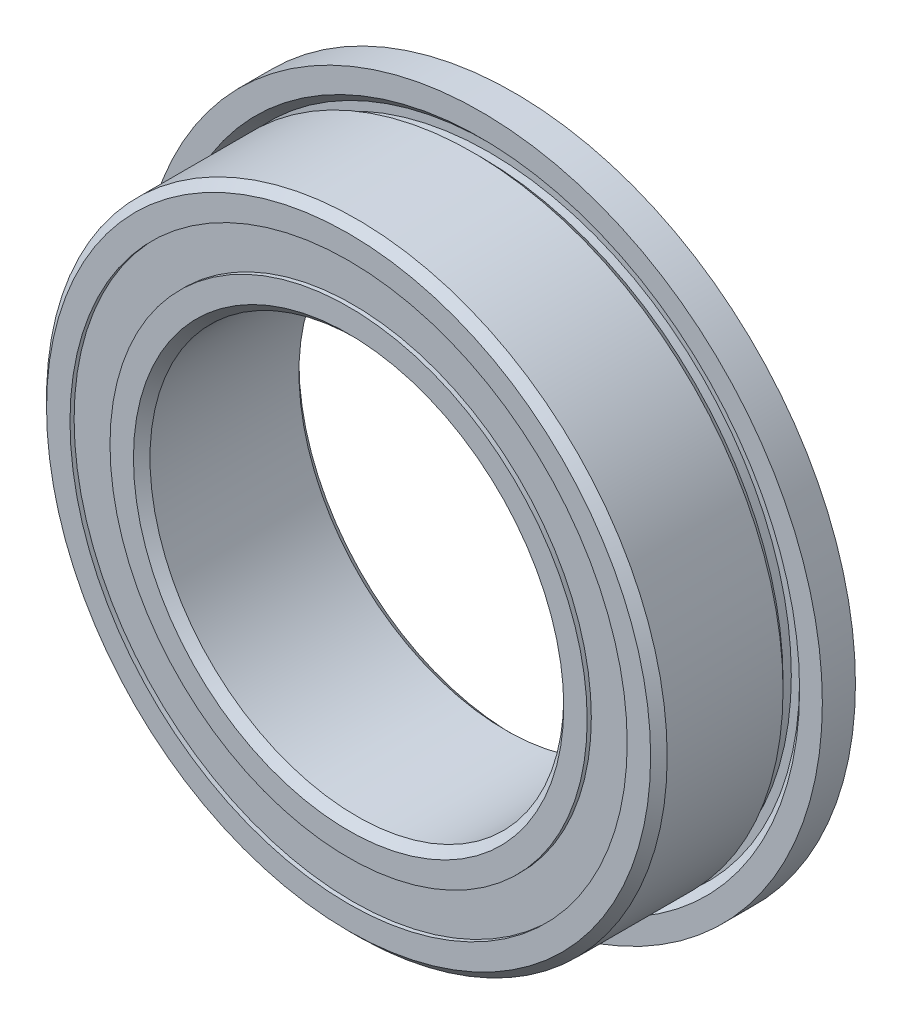
from build123d import *

# Parameters (mm, degrees)
SKETCH6_W         = 0.161172162
SKETCH6_H         = 0.483516484
CIRPATTERN1_COUNT = 11
SKETCH5_W         = 0.888114806
SKETCH5_H         = 0.967032968


with BuildPart() as part:
    # Sketch7 → Revolve7 (revolve)
    with BuildSketch(Plane(origin=(0, 0, 0), x_dir=(0, 0, -1), z_dir=(1, 0, 0)), mode=Mode.PRIVATE) as revolve7_sk:
        with BuildLine():
            Line((2, 8.25), (1.2, 8.25))
            Line((1.2, 8.25), (1.2, 7.7))
            Line((1.2, 7.7), (1.4, 7.5))
            Line((1.4, 7.5), (1.4, 7.3))
            Line((1.4, 7.3), (1.2, 7.3))
            Line((1.2, 7.3), (1, 7.5))
            Line((1, 7.5), (-1.8, 7.5))
            Line((-1.8, 7.5), (-2, 7.3))
            Line((-2, 7.3), (-2, 6.733516484))
            Line((-2, 6.733516484), (-0.888888889, 6.733516484))
            ThreePointArc((-0.888888889, 6.733516484), (0, 7.261885194), (0.888888889, 6.733516484))
            Line((0.888888889, 6.733516484), (2, 6.733516484))
            Line((2, 6.733516484), (2, 7.3))
            Line((2, 7.3), (2, 8.25))
        make_face()
    revolve(revolve7_sk.sketch.rotate(Axis((0, 0, 2), (0, 0, -1)), 90), axis=Axis((0, 0, 2), (0, 0, -1)))


with BuildPart() as body_2:
    # Sketch3 → Revolve3 (revolve)
    with BuildSketch(Plane(origin=(0, 0, 0), x_dir=(0, 0, -1), z_dir=(1, 0, 0)), mode=Mode.PRIVATE) as revolve3_sk:
        with BuildLine():
            Line((-2, 5.766483516), (-0.888888889, 5.766483516))
            ThreePointArc((-0.888888889, 5.766483516), (0, 5.238114806), (0.888888889, 5.766483516))
            Line((0.888888889, 5.766483516), (2, 5.766483516))
            Line((2, 5.766483516), (2, 5.2))
            Line((2, 5.2), (1.8, 5))
            Line((1.8, 5), (-1.8, 5))
            Line((-1.8, 5), (-2, 5.2))
            Line((-2, 5.2), (-2, 5.766483516))
        make_face()
    revolve(revolve3_sk.sketch.rotate(Axis((0, 0, 2), (0, 0, -1)), 90), axis=Axis((0, 0, 2), (0, 0, -1)))


with BuildPart() as body_3:
    # Sketch6 → Revolve6 (revolve)
    with BuildSketch(Plane(origin=(0, 0, 0), x_dir=(0, 0, -1), z_dir=(1, 0, 0)), mode=Mode.PRIVATE) as revolve6_sk:
        with Locations((0, 6.25)):
            Rectangle(SKETCH6_W, SKETCH6_H)
    revolve(revolve6_sk.sketch.rotate(Axis((0, 0, 2), (0, 0, -1)), 90), axis=Axis((0, 0, 2), (0, 0, -1)))


with BuildPart() as body_4:
    # Sketch4 → Revolve4 (revolve)
    with BuildSketch(Plane(origin=(0, 0, 0), x_dir=(0, 0, -1), z_dir=(1, 0, 0))):
        with BuildLine():
            Line((-1.011885194, 6.25), (1.011885194, 6.25))
            ThreePointArc((1.011885194, 6.25), (0, 7.261885194), (-1.011885194, 6.25))
        make_face()
    revolve(axis=Axis((0, 6.25, 1.011885194), (0, 0, -1)))


with BuildPart() as cirpattern1_1:
    # CirPattern1: pattern copy
    add(body_4.part.rotate(Axis((0, 0, 0), (0, 0, 1)), 1 * 360 / CIRPATTERN1_COUNT))


with BuildPart() as cirpattern1_2:
    # CirPattern1: pattern copy
    add(body_4.part.rotate(Axis((0, 0, 0), (0, 0, 1)), 2 * 360 / CIRPATTERN1_COUNT))


with BuildPart() as cirpattern1_3:
    # CirPattern1: pattern copy
    add(body_4.part.rotate(Axis((0, 0, 0), (0, 0, 1)), 3 * 360 / CIRPATTERN1_COUNT))


with BuildPart() as cirpattern1_4:
    # CirPattern1: pattern copy
    add(body_4.part.rotate(Axis((0, 0, 0), (0, 0, 1)), 4 * 360 / CIRPATTERN1_COUNT))


with BuildPart() as cirpattern1_5:
    # CirPattern1: pattern copy
    add(body_4.part.rotate(Axis((0, 0, 0), (0, 0, 1)), 5 * 360 / CIRPATTERN1_COUNT))


with BuildPart() as cirpattern1_6:
    # CirPattern1: pattern copy
    add(body_4.part.rotate(Axis((0, 0, 0), (0, 0, 1)), 6 * 360 / CIRPATTERN1_COUNT))


with BuildPart() as cirpattern1_7:
    # CirPattern1: pattern copy
    add(body_4.part.rotate(Axis((0, 0, 0), (0, 0, 1)), 7 * 360 / CIRPATTERN1_COUNT))


with BuildPart() as cirpattern1_8:
    # CirPattern1: pattern copy
    add(body_4.part.rotate(Axis((0, 0, 0), (0, 0, 1)), 8 * 360 / CIRPATTERN1_COUNT))


with BuildPart() as cirpattern1_9:
    # CirPattern1: pattern copy
    add(body_4.part.rotate(Axis((0, 0, 0), (0, 0, 1)), 9 * 360 / CIRPATTERN1_COUNT))


with BuildPart() as cirpattern1_10:
    # CirPattern1: pattern copy
    add(body_4.part.rotate(Axis((0, 0, 0), (0, 0, 1)), 10 * 360 / CIRPATTERN1_COUNT))


with BuildPart() as body_15:
    # Sketch5 → Revolve5 (revolve)
    with BuildSketch(Plane(origin=(0, 0, 0), x_dir=(0, 0, -1), z_dir=(1, 0, 0)), mode=Mode.PRIVATE) as revolve5_sk:
        with Locations((-1.455942597, 6.25)):
            Rectangle(SKETCH5_W, SKETCH5_H)
        with Locations((1.455942597, 6.25)):
            Rectangle(SKETCH5_W, SKETCH5_H)
    revolve(revolve5_sk.sketch.rotate(Axis((0, 0, 2), (0, 0, -1)), 90), axis=Axis((0, 0, 2), (0, 0, -1)))


solid = Compound([part.part, body_2.part, body_3.part, body_4.part, cirpattern1_1.part, cirpattern1_2.part, cirpattern1_3.part, cirpattern1_4.part, cirpattern1_5.part, cirpattern1_6.part, cirpattern1_7.part, cirpattern1_8.part, cirpattern1_9.part, cirpattern1_10.part, body_15.part])
